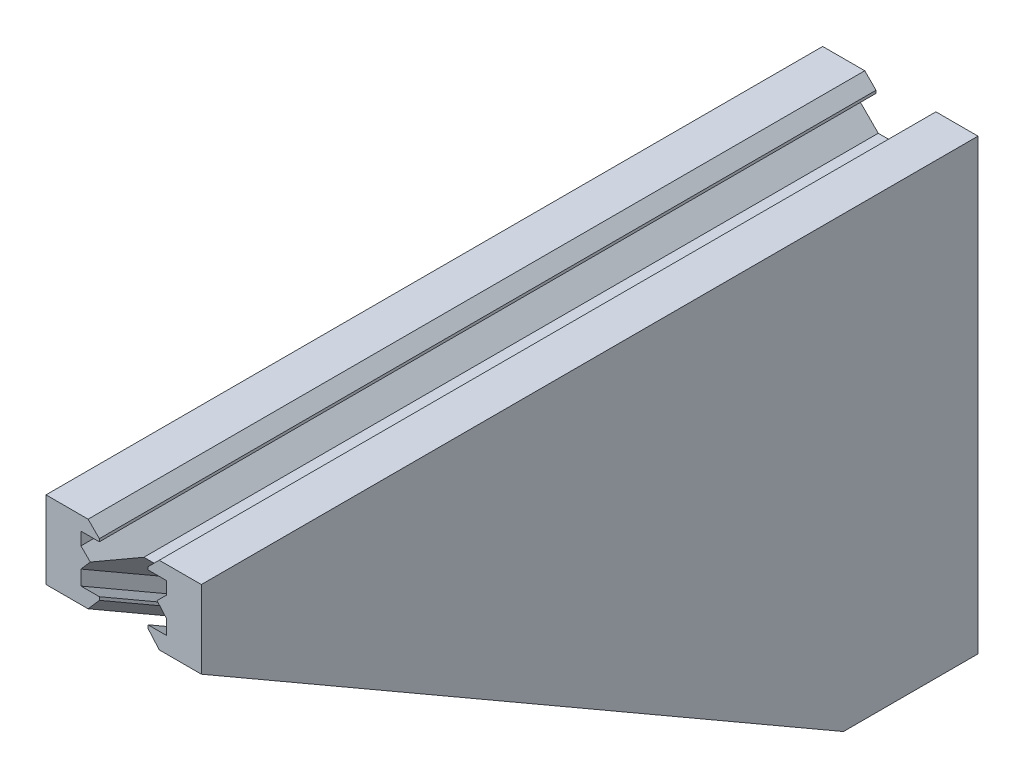
from build123d import *

# Parameters (mm, degrees)
PROFILE_START                   = -10
PROFILE_EXTRUDE_DEPTH           = 20
TOP_T_NUT_SLOT_CUT_DEPTH        = 122.194199002
FRONT_EDGE_CHAMFER_SIZE         = 10
FRONT_EDGE_CHAMFER_SIZE2        = 20
FRONT_T_NUT_SLOT_CUT_DEPTH      = 127.560696268
FRONT_T_NUT_SLOT_CUT_DEPTH_BACK = 95.470054


with BuildPart() as part:
    # Profile Sketch → Profile Extrude (new body)
    with BuildSketch(Plane(origin=(0, -25.324194998, 100.875319125), x_dir=(0, 1, 0), z_dir=(1, 0, 0)).offset(PROFILE_START)):
        Polygon((-42.410831921, -100.875319125), (15.324194998, -0.875319125), (25.324194998, -0.875319125), (25.324194998, -100.875319125), align=None)
    extrude(amount=PROFILE_EXTRUDE_DEPTH)

    # Top T-Nut Slot Sketch → Top T-Nut Slot Cut (cut, through all)
    with BuildSketch(Plane.XY.offset(100)):
        Polygon((-4.58, 0), (-3.13, -1.45), (-3.13, -1.8), (-5.5, -1.8), (-5.5, -3.44), (-2.84, -6.1), (2.84, -6.1), (5.5, -3.44), (5.5, -1.8), (3.13, -1.8), (3.13, -1.45), (4.58, 0), align=None)
    extrude(amount=-TOP_T_NUT_SLOT_CUT_DEPTH, mode=Mode.SUBTRACT)

    # Front Edge Chamfer
    front_edge_chamfer_edges = [part.edges().sort_by_distance(p)[0] for p in [
        (0, -67.735026919, 0),
    ]]
    front_edge_chamfer_side = [part.faces().sort_by_distance(p)[0] for p in [
        (0, -35.138756164, 0),
    ]]
    chamfer(front_edge_chamfer_edges, length=FRONT_EDGE_CHAMFER_SIZE, length2=FRONT_EDGE_CHAMFER_SIZE2, reference=front_edge_chamfer_side[0])

    # Front T-Nut Slot Sketch → Front T-Nut Slot Cut (cut, two sides: drawn at the far end of the back side and taken through both)
    with BuildSketch(Plane(origin=(20, 44.249147411, 68.679240139), x_dir=(-1, 0, 0), z_dir=(0, 0.5000000000000038, 0.8660254037844364)).offset(-FRONT_T_NUT_SLOT_CUT_DEPTH_BACK)):
        Polygon((15.42, 62.641519722), (16.87, 61.191519722), (16.87, 60.841519722), (14.5, 60.841519722), (14.5, 59.201519722), (17.16, 56.541519722), (22.84, 56.541519722), (25.5, 59.201519722), (25.5, 60.841519722), (23.13, 60.841519722), (23.13, 61.191519722), (24.58, 62.641519722), align=None)
    extrude(amount=FRONT_T_NUT_SLOT_CUT_DEPTH + FRONT_T_NUT_SLOT_CUT_DEPTH_BACK, mode=Mode.SUBTRACT)


solid = part.part
